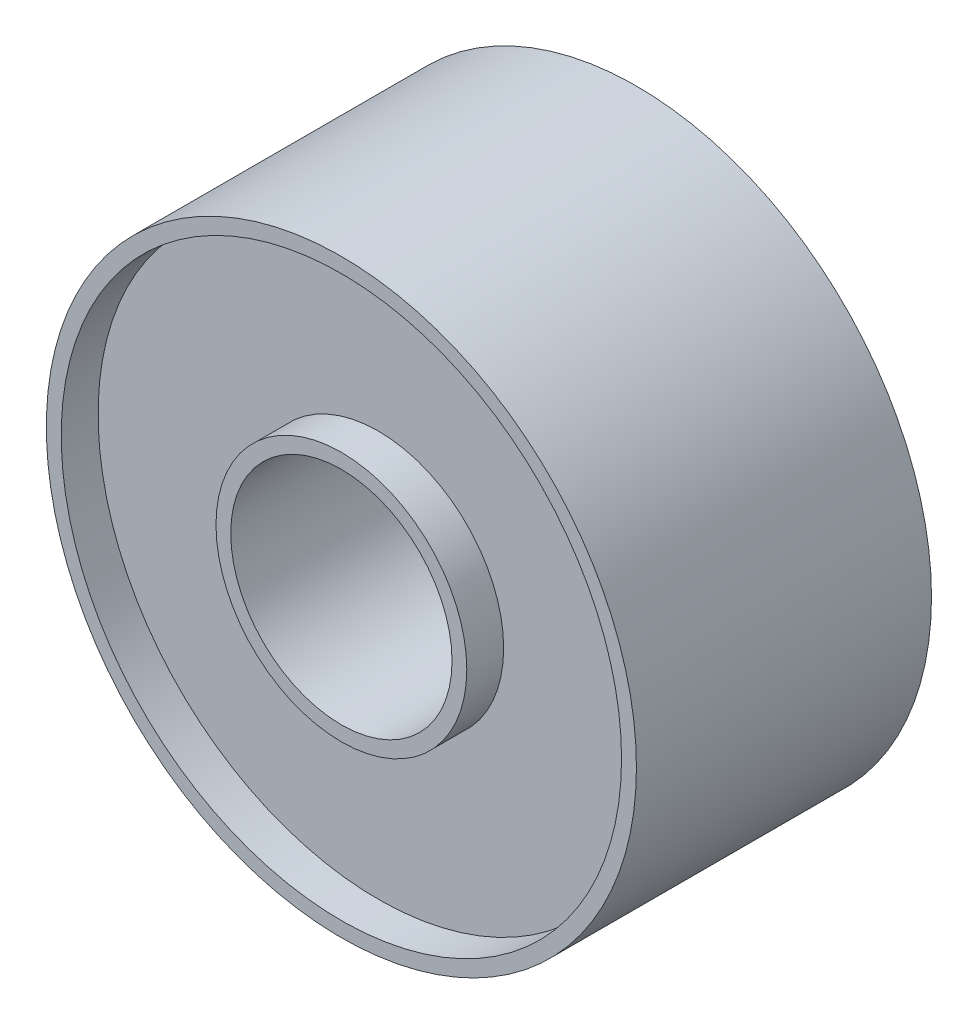
from build123d import *

# Parameters (mm, degrees)
SKETCH1_R           = 4
SKETCH1_R_2         = 1.5
BOSS_EXTRUDE1_DEPTH = 4
SKETCH2_R           = 3.798207028
SKETCH2_R_2         = 1.7
CUT_EXTRUDE2_DEPTH  = 0.5
CUT_EXTRUDE3_START  = -0.5
SKETCH3_R           = 3.798207028
SKETCH3_R_2         = 1.7
CUT_EXTRUDE3_DEPTH  = 0.5


with BuildPart() as part:
    # Sketch1 → Boss-Extrude1 (new body)
    with BuildSketch(Plane.XY):
        Circle(SKETCH1_R)
        Circle(SKETCH1_R_2, mode=Mode.SUBTRACT)
    extrude(amount=BOSS_EXTRUDE1_DEPTH)

    # Sketch2 → Cut-Extrude2 (cut)
    with BuildSketch(Plane.XY.offset(4)):
        Circle(SKETCH2_R)
        Circle(SKETCH2_R_2, mode=Mode.SUBTRACT)
    extrude(amount=-CUT_EXTRUDE2_DEPTH, mode=Mode.SUBTRACT)

    # Sketch3 → Cut-Extrude3 (cut)
    with BuildSketch(Plane(origin=(0, 0, 0), x_dir=(-1, 0, 0), z_dir=(0, 0, -1)).offset(CUT_EXTRUDE3_START)):
        with Locations(Location((0, 0, 0), (0, 0, 180))):
            Circle(SKETCH3_R)
        with Locations(Location((0, 0, 0), (0, 0, 180))):
            Circle(SKETCH3_R_2, mode=Mode.SUBTRACT)
    extrude(amount=CUT_EXTRUDE3_DEPTH, mode=Mode.SUBTRACT)


solid = part.part
